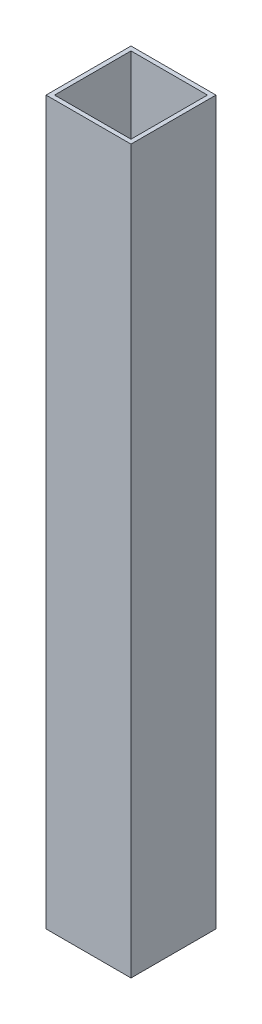
from build123d import *

# Parameters (mm, degrees)
SKETCH1_W           = 40
SKETCH1_H           = 40
SKETCH1_W_2         = 36
SKETCH1_H_2         = 36
EXTRUDE_THIN1_DEPTH = 340


with BuildPart() as part:
    # Sketch1 → Extrude-Thin1 (new body)
    with BuildSketch(Plane(origin=(0, 0, 0), x_dir=(1, 0, 0), z_dir=(0, 1, 0))):
        with Locations((-20, 20)):
            Rectangle(SKETCH1_W, SKETCH1_H)
        with Locations((-20, 20)):
            Rectangle(SKETCH1_W_2, SKETCH1_H_2, mode=Mode.SUBTRACT)
    extrude(amount=EXTRUDE_THIN1_DEPTH)


solid = part.part
